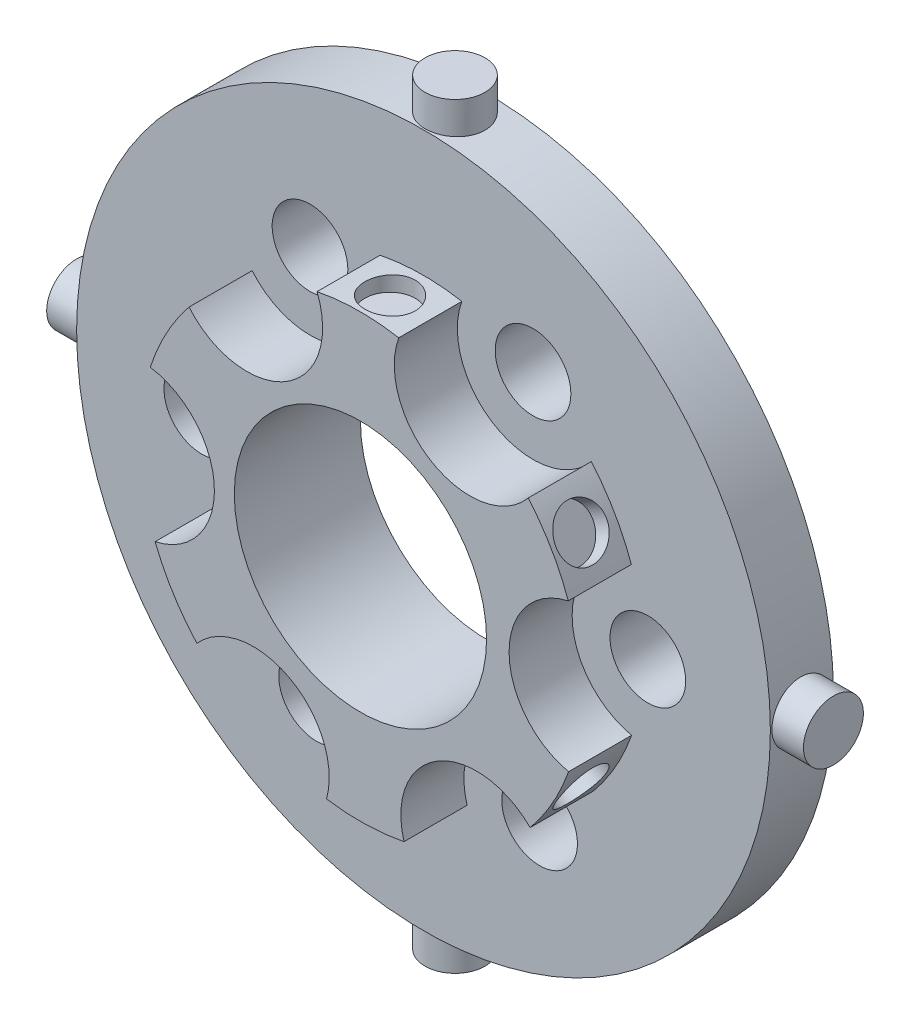
from build123d import *

# Parameters (mm, degrees)
CROQUIS1_R              = 55
CROQUIS1_R_2            = 20
SALIENTE_EXTRUIR1_DEPTH = 10
CROQUIS2_R              = 6
CROQUIS2_R_2            = 20
SALIENTE_EXTRUIR2_DEPTH = 20
CROQUIS3_R              = 6
CORTAR_EXTRUIR2_DEPTH   = 81.311892021
CROQUIS4_R              = 4.75
SALIENTE_EXTRUIR3_DEPTH = 5
MATRIZC1_COUNT          = 4
CROQUIS5_R              = 4
CORTAR_EXTRUIR3_DEPTH   = 2.5
MATRIZC2_COUNT          = 6


with BuildPart() as part:
    # Croquis1 → Saliente-Extruir1 (new body)
    with BuildSketch(Plane.XY):
        Circle(CROQUIS1_R)
        Circle(CROQUIS1_R_2, mode=Mode.SUBTRACT)
    extrude(amount=SALIENTE_EXTRUIR1_DEPTH)

    # Croquis2 → Saliente-Extruir2 (add)
    # profile 1 of 7: a face of its own
    with BuildSketch(Plane.XY):
        with Locations((17.368749874, 30.386288484)):
            Circle(CROQUIS2_R)
    # profile 2 of 7: a face of its own
    with BuildSketch(Plane.XY):
        with Locations((35.570236927, 0.06310586)):
            Circle(CROQUIS2_R)
    # profile 3 of 7: a face of its own
    with BuildSketch(Plane.XY):
        with Locations((18.410333978, -30.861435627)):
            Circle(CROQUIS2_R)
    # profile 4 of 7: a face of its own
    with BuildSketch(Plane.XY):
        with Locations((-16.951056024, -31.462794489)):
            Circle(CROQUIS2_R)
    # profile 5 of 7: a face of its own
    with BuildSketch(Plane.XY):
        with Locations((-35.152543077, -1.139611866)):
            Circle(CROQUIS2_R)
    # profile 6 of 7: a face of its own
    with BuildSketch(Plane.XY):
        with Locations((-17.992640128, 29.784929621)):
            Circle(CROQUIS2_R)
    # profile 7 of 7: a face of its own
    with BuildSketch(Plane.XY):
        with BuildLine():
            ThreePointArc((-27.174096814, 22.058296905), (-30.772867756, 16.67424991), (-33.318098438, 10.719343099))
            ThreePointArc((-33.318098438, 10.719343099), (-23.158844078, -0.750787602), (-32.553845663, -12.8548486))
            ThreePointArc((-32.553845663, -12.8548486), (-29.724252158, -18.478875336), (-25.932896476, -23.504996924))
            ThreePointArc((-25.932896476, -23.504996924), (-11.259372102, -20.898480308), (-5.36472656, -34.58640931))
            ThreePointArc((-5.36472656, -34.58640931), (0.788104907, -34.991125884), (6.916475444, -34.309799875))
            ThreePointArc((6.916475444, -34.309799875), (12.262561294, -20.555859902), (26.90508267, -22.385632145))
            ThreePointArc((26.90508267, -22.385632145), (30.429526117, -17.292886986), (33.001146459, -11.658659117))
            ThreePointArc((33.001146459, -11.658659117), (23.570255812, 0.041816456), (32.959571133, 11.775681328))
            ThreePointArc((32.959571133, 11.775681328), (30.28541045, 17.544056369), (26.611824153, 22.733473454))
            ThreePointArc((26.611824153, 22.733473454), (11.413749917, 19.968132432), (6.083961325, 34.467164296))
            ThreePointArc((6.083961325, 34.467164296), (-0.405697858, 34.997648625), (-6.881315891, 34.316868907))
            ThreePointArc((-6.881315891, 34.316868907), (-11.787864219, 19.513573531), (-27.174096814, 22.058296905))
        make_face()
        Circle(CROQUIS2_R_2, mode=Mode.SUBTRACT)
    extrude(amount=SALIENTE_EXTRUIR2_DEPTH)

    # Croquis3 → Cortar-Extruir2 (cut, through all)
    with BuildSketch(Plane.XY.offset(20)):
        with Locations((-17.992640128, 29.784929621)):
            Circle(CROQUIS3_R)
        with Locations((-35.152543077, -1.139611866)):
            Circle(CROQUIS3_R)
        with Locations((-16.951056024, -31.462794489)):
            Circle(CROQUIS3_R)
        with Locations((18.410333978, -30.861435627)):
            Circle(CROQUIS3_R)
        with Locations((35.570236927, 0.06310586)):
            Circle(CROQUIS3_R)
        with Locations((17.368749874, 30.386288484)):
            Circle(CROQUIS3_R)
    extrude(amount=-CORTAR_EXTRUIR2_DEPTH, mode=Mode.SUBTRACT)

    # Croquis4 → Saliente-Extruir3 (add, symmetric)
    with BuildSketch(Plane(origin=(0, 55, 0), x_dir=(1, 0, 0), z_dir=(0, 1, 0))):
        with Locations(Location((0, -5.001814487, 0), (0, 0, 90))):
            Circle(CROQUIS4_R)
    saliente_extruir3 = extrude(amount=SALIENTE_EXTRUIR3_DEPTH, both=True)

    # MatrizC1: Saliente-Extruir3 ×4 about axis
    matrizc1_axis = Axis((0, 0, 0), (0, 0, 1))
    for i in range(1, MATRIZC1_COUNT):
        add(saliente_extruir3.rotate(matrizc1_axis, i * 360 / MATRIZC1_COUNT))

    # Croquis5 → Cortar-Extruir3 (cut, symmetric)
    with BuildSketch(Plane(origin=(0, 35, 0), x_dir=(1, 0, 0), z_dir=(0, 1, 0))):
        with Locations(Location((0, -15.307164254, 0), (0, 0, 270))):
            Circle(CROQUIS5_R)
    cortar_extruir3 = extrude(amount=CORTAR_EXTRUIR3_DEPTH, both=True, mode=Mode.SUBTRACT)

    # MatrizC2: Cortar-Extruir3 ×6 about axis
    matrizc2_axis = Axis((0, 0, 0), (0, 0, 1))
    for i in range(1, MATRIZC2_COUNT):
        add(cortar_extruir3.rotate(matrizc2_axis, i * 360 / MATRIZC2_COUNT), mode=Mode.SUBTRACT)


solid = part.part
